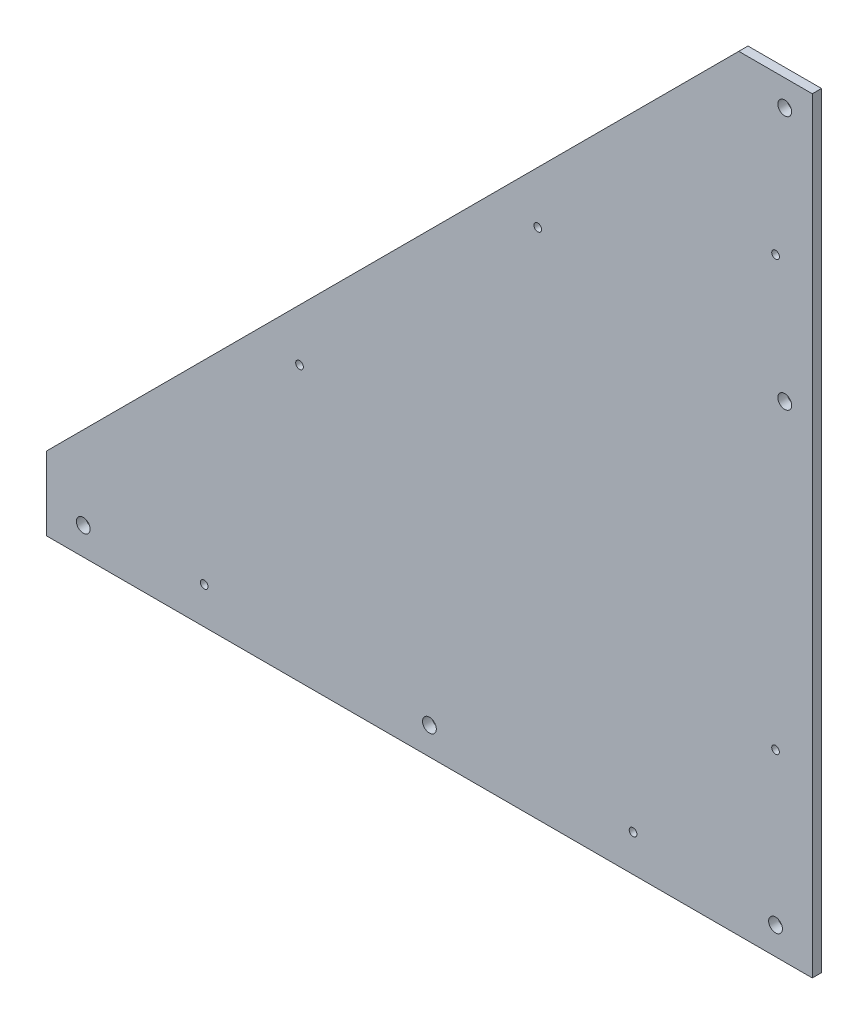
from build123d import *

# Parameters (mm, degrees)
BOSS_EXTRU_1_DEPTH      = 6
ESQUISSE2_R             = 4.5
ENL_V_MAT_EXTRU_1_DEPTH = 708.132236572
ESQUISSE5_R             = 2.5
ENL_V_MAT_EXTRU_3_DEPTH = 708.132236572
CHANFREIN2_SIZE         = 2


with BuildPart() as part:
    # Esquisse1 → Boss.-Extru.1 (new body)
    with BuildSketch(Plane.XY):
        Polygon((0, 0), (0, 48), (452, 500), (500, 500), (500, 0), align=None)
    extrude(amount=BOSS_EXTRU_1_DEPTH)

    # Esquisse2 → Enlèv. mat.-Extru.1 (cut, through all)
    with BuildSketch(Plane.XY.offset(6)):
        with Locations((24, 18)):
            Circle(ESQUISSE2_R)
        with Locations((250, 18)):
            Circle(ESQUISSE2_R)
        with Locations((476, 18)):
            Circle(ESQUISSE2_R)
        with Locations((482, 483)):
            Circle(ESQUISSE2_R)
        with Locations((482, 317)):
            Circle(ESQUISSE2_R)
    extrude(amount=-ENL_V_MAT_EXTRU_1_DEPTH, mode=Mode.SUBTRACT)

    # Esquisse5 → Enlèv. mat.-Extru.3 (cut, through all)
    with BuildSketch(Plane.XY.offset(6)):
        with Locations((165.188816818, 179.247691321)):
            Circle(ESQUISSE5_R)
        with Locations((320.752308679, 334.811183182)):
            Circle(ESQUISSE5_R)
        with Locations((102.970562748, 24)):
            Circle(ESQUISSE5_R)
        with Locations((382.970562748, 24)):
            Circle(ESQUISSE5_R)
        with Locations((476, 397.029437252)):
            Circle(ESQUISSE5_R)
        with Locations((476, 117.029437252)):
            Circle(ESQUISSE5_R)
    extrude(amount=-ENL_V_MAT_EXTRU_3_DEPTH, mode=Mode.SUBTRACT)

    # Chanfrein2
    chanfrein2_edges = [part.edges().sort_by_distance(p)[0] for p in [
        (318.252308679, 334.811183182, 0),
        (100.470562748, 24, 0),
        (380.470562748, 24, 0),
        (473.5, 397.029437252, 0),
        (473.5, 117.029437252, 0),
        (162.688816818, 179.247691321, 0),
    ]]
    chamfer(chanfrein2_edges, length=CHANFREIN2_SIZE)


solid = part.part
